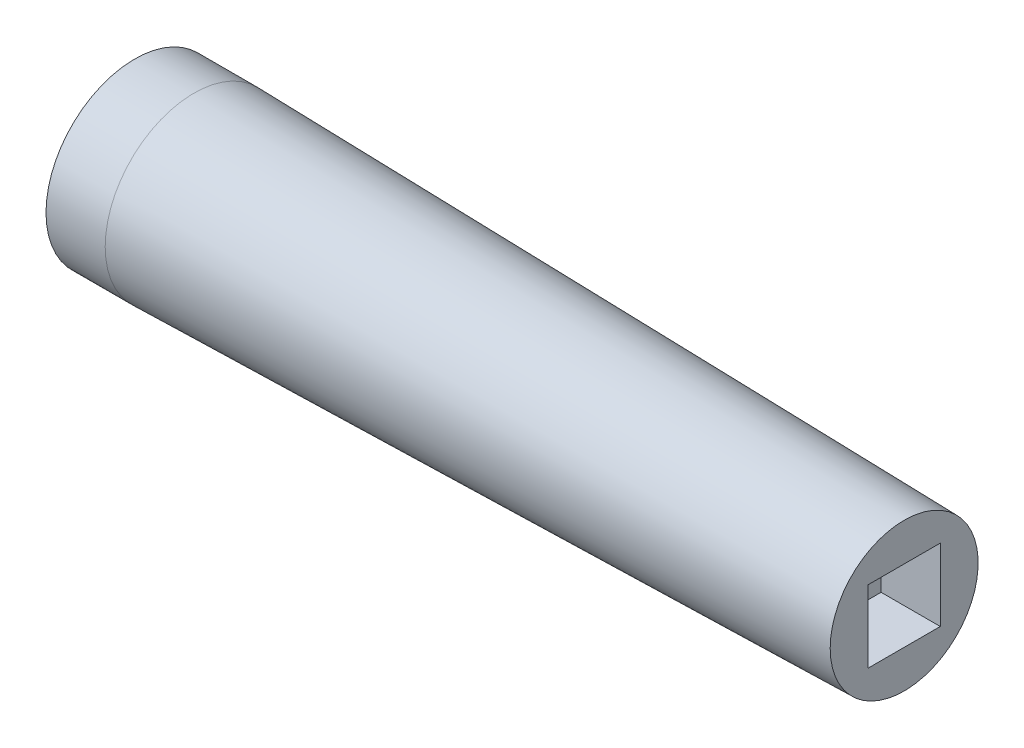
from build123d import *

# Parameters (mm, degrees)
SKETCH3_W          = 15.494
SKETCH3_H          = 15.494
CUT_EXTRUDE1_DEPTH = 12.7


with BuildPart() as part:
    # Sketch1 → Revolve2 (revolve)
    with BuildSketch(Plane.XY, mode=Mode.PRIVATE) as revolve2_sk:
        Polygon((0, 0), (165.1, 0), (165.1, 15.875), (12.7, 19.05), (0, 19.05), align=None)
    revolve(revolve2_sk.sketch.rotate(Axis((0, 0, 0), (1, 0, 0)), 90), axis=Axis((0, 0, 0), (1, 0, 0)))

    # Sketch3 → Cut-Extrude1 (cut)
    with BuildSketch(Plane(origin=(165.1, 0, 0), x_dir=(0, 0, -1), z_dir=(1, 0, 0))):
        Rectangle(SKETCH3_W, SKETCH3_H)
    extrude(amount=-CUT_EXTRUDE1_DEPTH, mode=Mode.SUBTRACT)


solid = part.part
